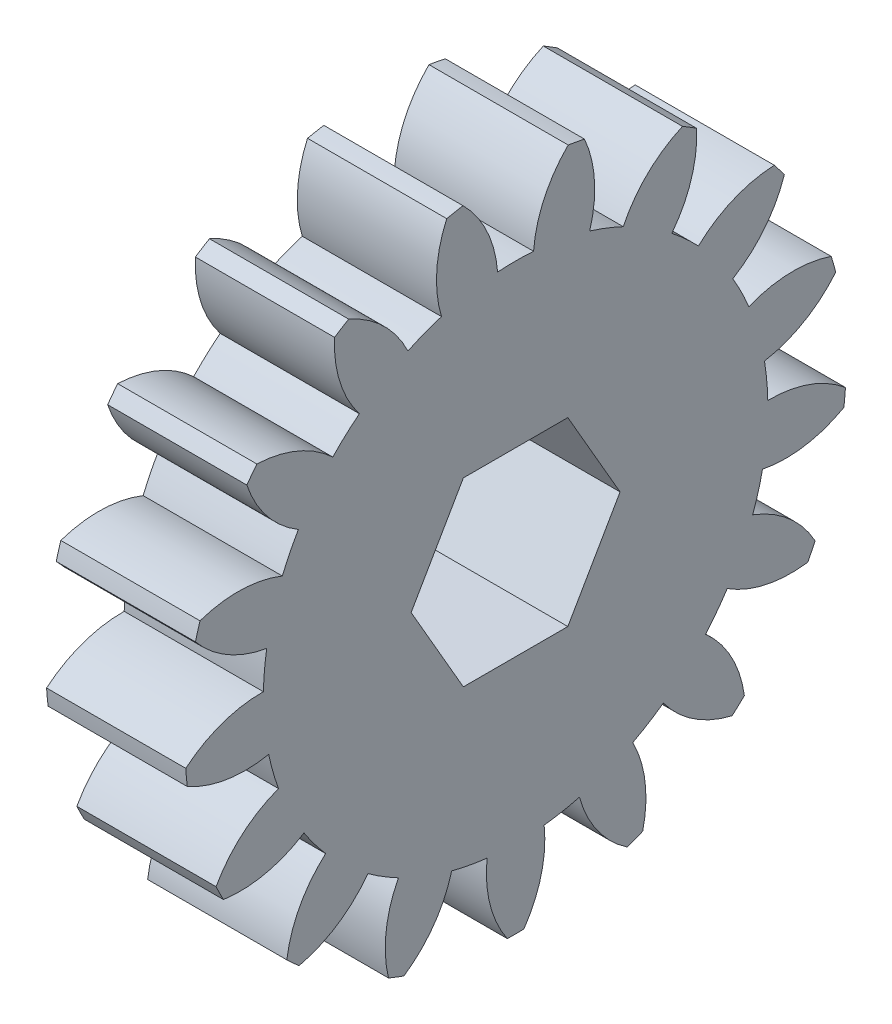
from build123d import *

# Parameters (mm, degrees)
BASPROSKE_W        = 4
BASPROSKE_H        = 9.5
TOOTHCUT_DEPTH     = 15.017845769
TEETHCUTS_COUNT    = 17
TEETHCUTS_ANGLE    = 338.823529412
BORSKE_R           = 0.4
BORE_DEPTH         = 50.0000508
CUT_EXTRUDE1_DEPTH = 15.003283988


with BuildPart() as part:
    # BasProSke → Base-Revolve (revolve)
    with BuildSketch(Plane(origin=(0, 0, 0), x_dir=(1, 0, 0), z_dir=(0, 1, 0)), mode=Mode.PRIVATE) as base_revolve_sk:
        with Locations((2, 4.75)):
            Rectangle(BASPROSKE_W, BASPROSKE_H)
    revolve(base_revolve_sk.sketch.rotate(Axis((-10, 0, 0), (1, 0, 0)), 180), axis=Axis((-10, 0, 0), (1, 0, 0)))

    # TooCutSke → ToothCut (cut, through all)
    with BuildSketch(Plane(origin=(0, 0, 0), x_dir=(0, 0, -1), z_dir=(1, 0, 0))):
        with BuildLine():
            ThreePointArc((0.516861231, 7.23055015), (0, 7.249), (-0.516861231, 7.23055015))
            ThreePointArc((-0.516861231, 7.23055015), (-0.827352654, 8.408398361), (-1.533069197, 9.401220346))
            ThreePointArc((-1.533069197, 9.401220346), (0, 9.5254), (1.533069197, 9.401220346))
            ThreePointArc((1.533069197, 9.401220346), (0.827352654, 8.408398361), (0.516861231, 7.23055015))
        make_face()
    toothcut = extrude(amount=TOOTHCUT_DEPTH, mode=Mode.SUBTRACT)

    # TeethCuts: ToothCut ×17 about axis
    teethcuts_axis = Axis((-10, 0, 0), (1, 0, 0))
    for i in range(1, TEETHCUTS_COUNT):
        add(toothcut.rotate(teethcuts_axis, i * TEETHCUTS_ANGLE / (TEETHCUTS_COUNT - 1)), mode=Mode.SUBTRACT)

    # BorSke → Bore (cut, symmetric)
    with BuildSketch(Plane(origin=(0, 0, 0), x_dir=(0, 0, -1), z_dir=(1, 0, 0))):
        with Locations(Location((0, 0, 0), (0, 0, 180))):
            Circle(BORSKE_R)
    extrude(amount=BORE_DEPTH, both=True, mode=Mode.SUBTRACT)

    # Sketch1 → Cut-Extrude1 (cut, through all)
    with BuildSketch(Plane(origin=(4, 0, 0), x_dir=(0, 0, -1), z_dir=(1, 0, 0))):
        Polygon((3.0022214, 0), (1.5011107, 2.6), (-1.5011107, 2.6), (-3.0022214, 0), (-1.5011107, -2.6), (1.5011107, -2.6), align=None)
    extrude(amount=-CUT_EXTRUDE1_DEPTH, mode=Mode.SUBTRACT)


solid = part.part
